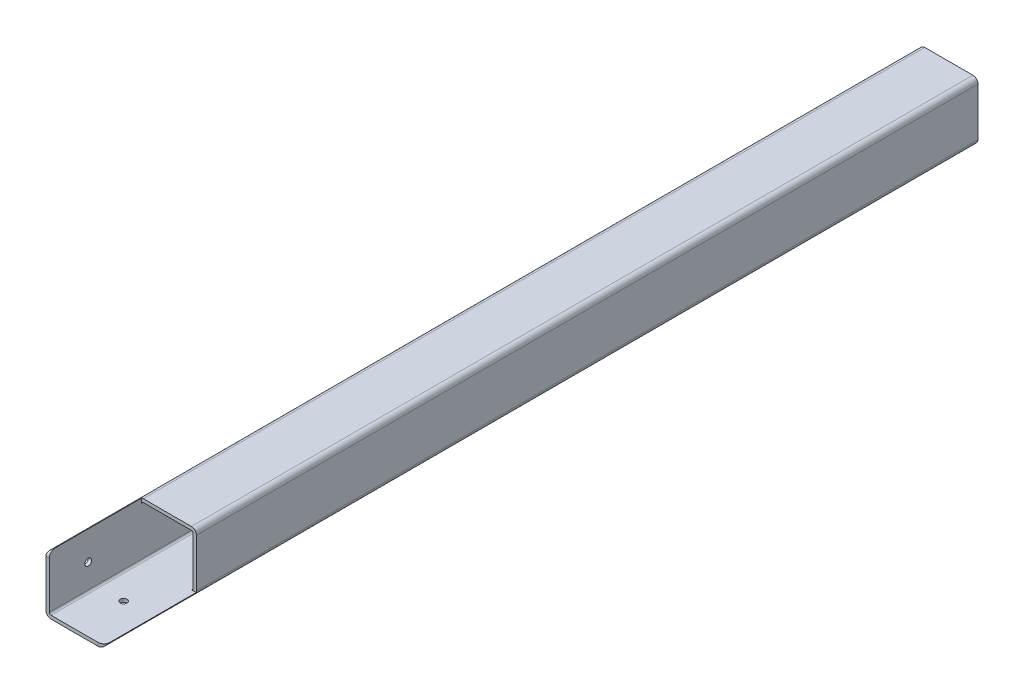
from build123d import *

# Parameters (mm, degrees)
EXTRUDE_1_DEPTH     = 450
CUT_EXTRUDE_1_DEPTH = 95
SKETCH_3_R          = 3.5
CUT_EXTRUDE_2_DEPTH = 455.972526643
SKETCH_4_R          = 3.5
CUT_EXTRUDE_3_DEPTH = 455.972526762


with BuildPart() as part:
    # Эскиз1 → Бобышка-Вытянуть1 (new, symmetric)
    with BuildSketch(Plane(origin=(0, 0, 0), x_dir=(0, 1, 0), z_dir=(0, 0, 1))):
        with BuildLine():
            Line((24.75, 30), (-24.75, 30))
            ThreePointArc((-24.75, 30), (-28.462310601, 28.462310601), (-30, 24.75))
            Line((-30, 24.75), (-30, -24.75))
            ThreePointArc((-30, -24.75), (-28.462310601, -28.462310601), (-24.75, -30))
            Line((-24.75, -30), (24.75, -30))
            ThreePointArc((24.75, -30), (28.462310601, -28.462310601), (30, -24.75))
            Line((30, -24.75), (30, 24.75))
            ThreePointArc((30, 24.75), (28.462310601, 28.462310601), (24.75, 30))
        make_face()
        with BuildLine():
            Line((-24.75, -26.5), (24.75, -26.5))
            ThreePointArc((24.75, -26.5), (25.987436867, -25.987436867), (26.5, -24.75))
            Line((26.5, -24.75), (26.5, 24.75))
            ThreePointArc((26.5, 24.75), (25.987436867, 25.987436867), (24.75, 26.5))
            Line((24.75, 26.5), (-24.75, 26.5))
            ThreePointArc((-24.75, 26.5), (-25.987436867, 25.987436867), (-26.5, 24.75))
            Line((-26.5, 24.75), (-26.5, -24.75))
            ThreePointArc((-26.5, -24.75), (-25.987436867, -25.987436867), (-24.75, -26.5))
        make_face(mode=Mode.SUBTRACT)
    extrude(amount=EXTRUDE_1_DEPTH, both=True)

    # Эскиз2 → Вырез-Вытянуть1 (cut)
    with BuildSketch(Plane.XY.offset(450)):
        Polygon((-26.5, 30), (30, 30), (30, -26.5), (-24.75, -26.5), (-26.5, -24.75), align=None)
    extrude(amount=-CUT_EXTRUDE_1_DEPTH, mode=Mode.SUBTRACT)

    # Эскиз3 → Вырез-Вытянуть2 (cut, through all)
    with BuildSketch(Plane.XZ.offset(30)):
        with Locations((0, 400)):
            Circle(SKETCH_3_R)
        with BuildLine():
            Line((23.699747468, 450), (29.699747468, 450))
            Line((29.699747468, 450), (29.699747468, 444))
            ThreePointArc((29.699747468, 444), (27.942388155, 448.242640687), (23.699747468, 450))
        make_face()
    extrude(amount=-CUT_EXTRUDE_2_DEPTH, mode=Mode.SUBTRACT)

    # Эскиз4 → Вырез-Вытянуть3 (cut, through all)
    with BuildSketch(Plane.ZY.offset(30)):
        with Locations(Location((410, 0, 0), (0, 0, 270))):
            Circle(SKETCH_4_R)
        with BuildLine():
            Line((444, 29.699747468), (450, 29.699747468))
            Line((450, 29.699747468), (450, 23.699747468))
            ThreePointArc((450, 23.699747468), (448.242640687, 27.942388155), (444, 29.699747468))
        make_face()
    extrude(amount=-CUT_EXTRUDE_3_DEPTH, mode=Mode.SUBTRACT)


solid = part.part
